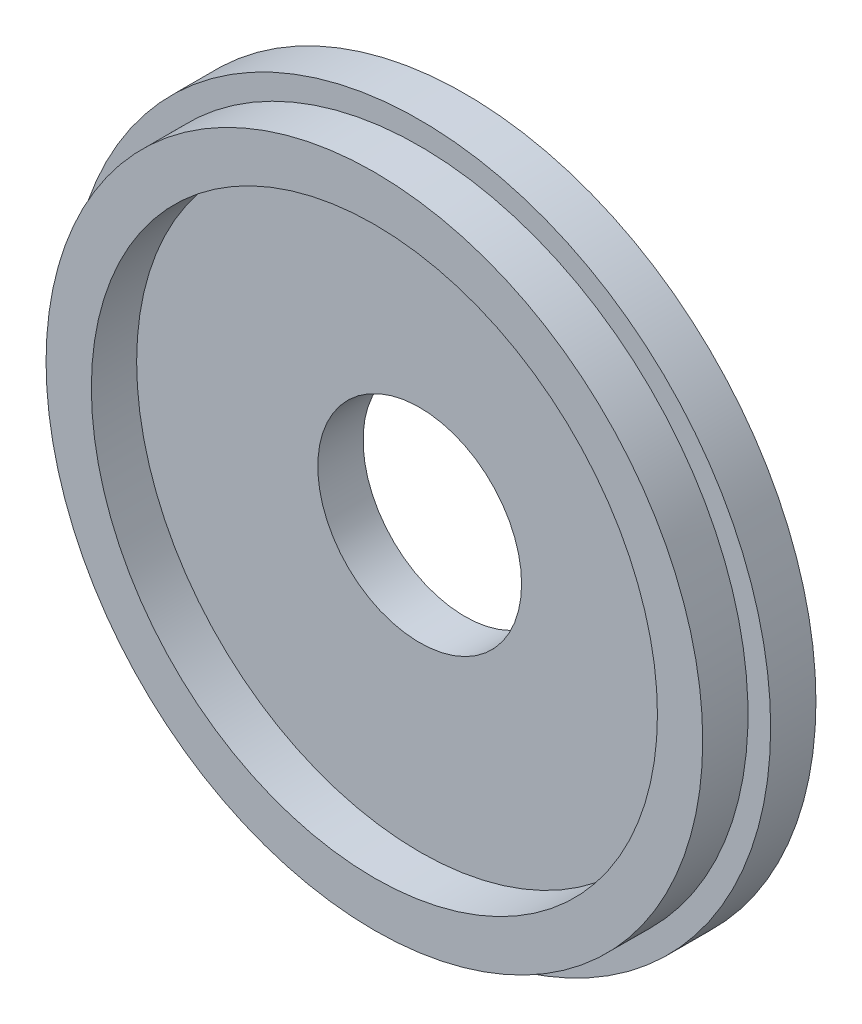
from build123d import *

# Parameters (mm, degrees)
SKETCH1_R           = 14.5
BOSS_EXTRUDE1_DEPTH = 2
SKETCH2_R           = 14.5
SKETCH2_R_2         = 12.5
BOSS_EXTRUDE2_DEPTH = 2
SKETCH3_R           = 4.5
CUT_EXTRUDE1_DEPTH  = 2
SKETCH4_R           = 15.5
SKETCH4_R_2         = 14.5
BOSS_EXTRUDE3_DEPTH = 2


with BuildPart() as part:
    # Sketch1 → Boss-Extrude1 (new body)
    with BuildSketch(Plane.XY):
        Circle(SKETCH1_R)
    extrude(amount=BOSS_EXTRUDE1_DEPTH)

    # Sketch2 → Boss-Extrude2 (add)
    with BuildSketch(Plane.XY.offset(2)):
        Circle(SKETCH2_R)
        Circle(SKETCH2_R_2, mode=Mode.SUBTRACT)
    extrude(amount=BOSS_EXTRUDE2_DEPTH)

    # Sketch3 → Cut-Extrude1 (cut)
    with BuildSketch(Plane.XY.offset(2)):
        Circle(SKETCH3_R)
    extrude(amount=-CUT_EXTRUDE1_DEPTH, mode=Mode.SUBTRACT)

    # Sketch4 → Boss-Extrude3 (add)
    with BuildSketch(Plane(origin=(0, 0, 0), x_dir=(-1, 0, 0), z_dir=(0, 0, -1))):
        Circle(SKETCH4_R)
        Circle(SKETCH4_R_2, mode=Mode.SUBTRACT)
    extrude(amount=-BOSS_EXTRUDE3_DEPTH)


solid = part.part
